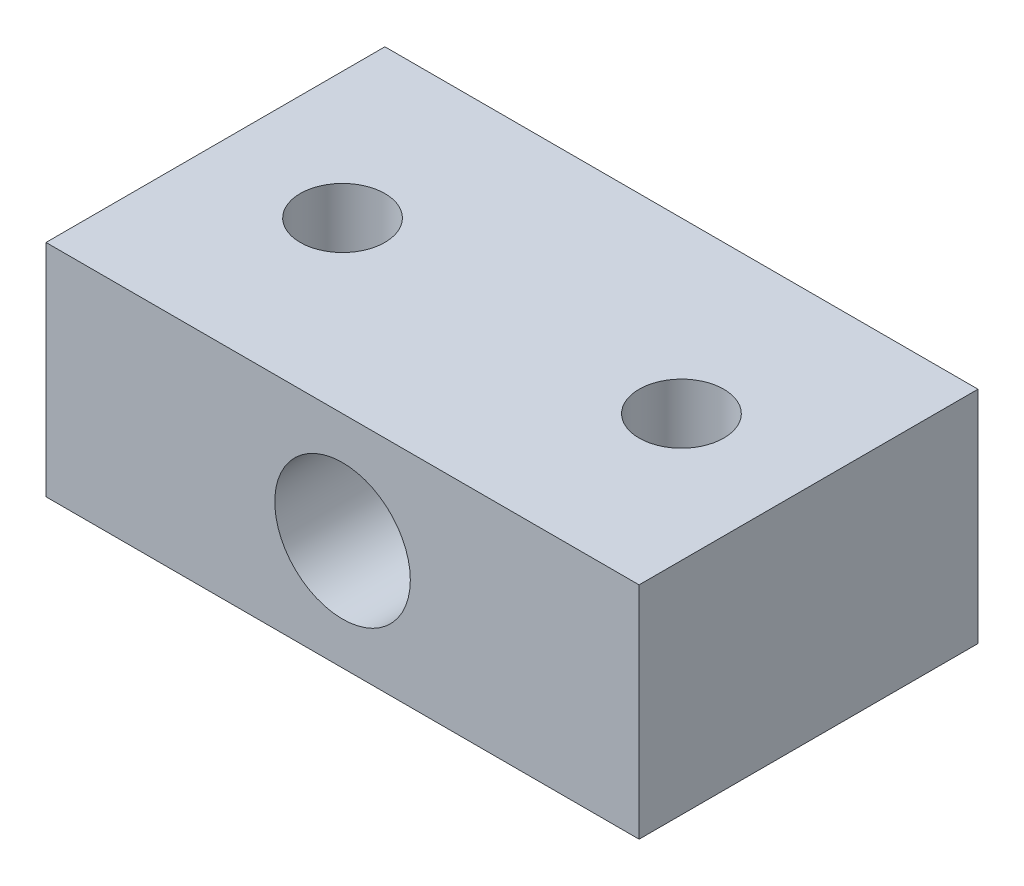
from build123d import *

# Parameters (mm, degrees)
SKETCH1_W           = 35
SKETCH1_H           = 20
SKETCH1_R           = 2.5
BOSS_EXTRUDE1_DEPTH = 13
SKETCH2_R           = 4
CUT_EXTRUDE1_DEPTH  = 30.584624385


with BuildPart() as part:
    # Sketch1 → Boss-Extrude1 (new body)
    with BuildSketch(Plane(origin=(0, 0, 0), x_dir=(1, 0, 0), z_dir=(0, 1, 0))):
        Rectangle(SKETCH1_W, SKETCH1_H)
        with Locations(Location((-10, 0, 0), (0, 0, 270))):
            Circle(SKETCH1_R, mode=Mode.SUBTRACT)
        with Locations(Location((10, 0, 0), (0, 0, 270))):
            Circle(SKETCH1_R, mode=Mode.SUBTRACT)
    extrude(amount=BOSS_EXTRUDE1_DEPTH)

    # Sketch2 → Cut-Extrude1 (cut, through all)
    with BuildSketch(Plane.XY.offset(10)):
        with Locations((0, 6.5)):
            Circle(SKETCH2_R)
    extrude(amount=-CUT_EXTRUDE1_DEPTH, mode=Mode.SUBTRACT)


solid = part.part
